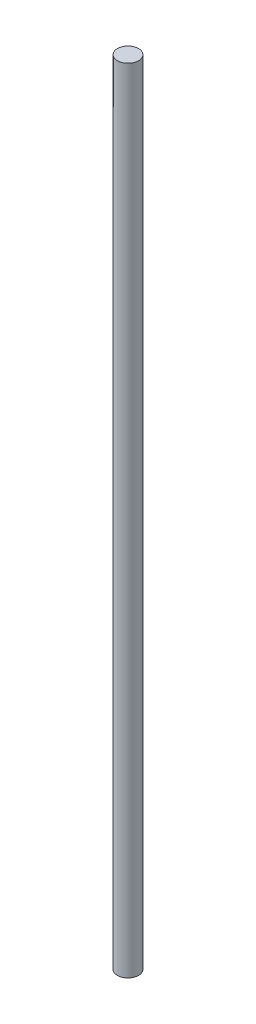
from build123d import *

# Parameters (mm, degrees)
SKETCH_1_R      = 1.5
EXTRUDE_1_DEPTH = 112.44


with BuildPart() as part:
    # 草图1 → 凸台-拉伸1 (new body)
    with BuildSketch(Plane(origin=(0, 0, 0), x_dir=(1, 0, 0), z_dir=(0, 1, 0))):
        with Locations(Location((0, 0, 0), (0, 0, 270))):
            Circle(SKETCH_1_R)
    extrude(amount=EXTRUDE_1_DEPTH)


solid = part.part
